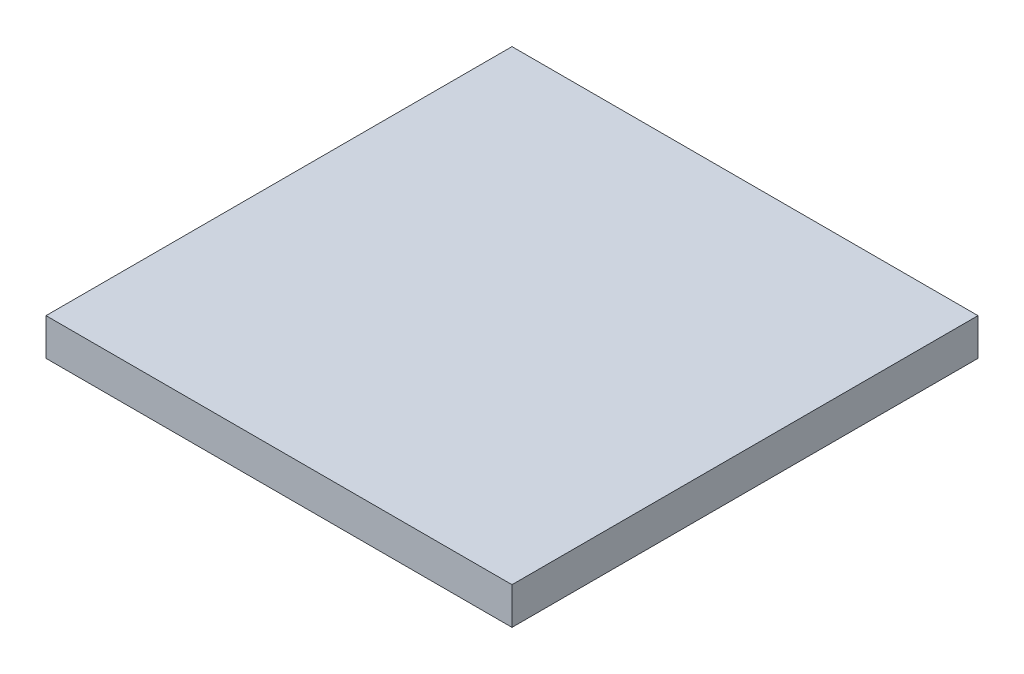
from build123d import *

# Parameters (mm, degrees)
SKETCH2_W           = 31.9786
SKETCH2_H           = 31.9786
BOSS_EXTRUDE1_DEPTH = 2.54


with BuildPart() as part:
    # Sketch2 → Boss-Extrude1 (new body)
    with BuildSketch(Plane(origin=(0, 0, 0), x_dir=(1, 0, 0), z_dir=(0, 1, 0))):
        with Locations((29.103626491, 13.321102219)):
            Rectangle(SKETCH2_W, SKETCH2_H)
    extrude(amount=BOSS_EXTRUDE1_DEPTH)


solid = part.part
